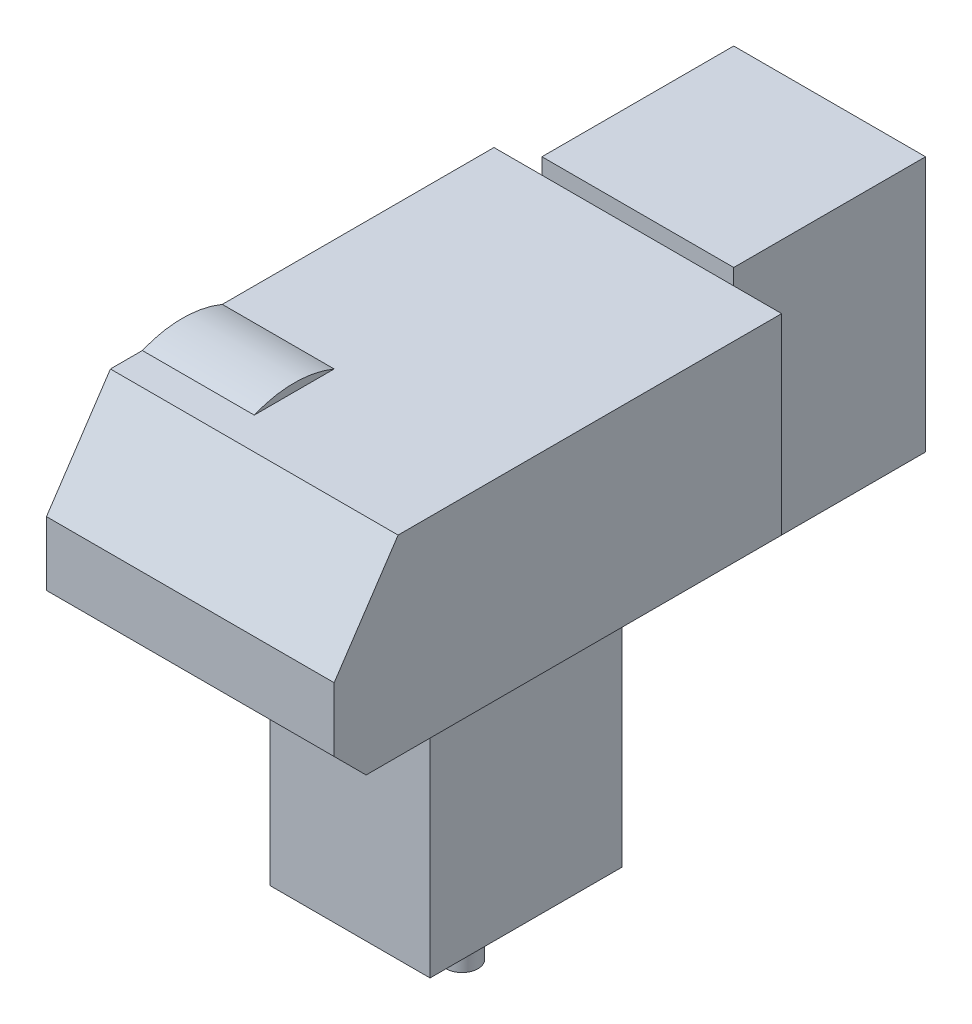
from build123d import *

# Parameters (mm, degrees)
SKETCH2_W           = 127
SKETCH2_H           = 152.4
BOSS_EXTRUDE2_DEPTH = 215.9
SKETCH3_W           = 228.6
SKETCH3_H           = 355.6
BOSS_EXTRUDE3_DEPTH = 152.4
SKETCH4_R           = 82.55
BOSS_EXTRUDE4_DEPTH = 88.9
CUT_EXTRUDE1_DEPTH  = 484.643280218
SKETCH6_W           = 152.4
SKETCH6_H           = 203.2
BOSS_EXTRUDE5_DEPTH = 152.4
SKETCH7_R           = 12.7
BOSS_EXTRUDE6_DEPTH = 63.5


with BuildPart() as part:
    # Sketch2 → Boss-Extrude2 (new body)
    with BuildSketch(Plane(origin=(0, 0, 0), x_dir=(1, 0, 0), z_dir=(0, 1, 0))):
        Rectangle(SKETCH2_W, SKETCH2_H)
    extrude(amount=BOSS_EXTRUDE2_DEPTH)

    # Sketch3 → Boss-Extrude3 (add)
    with BuildSketch(Plane(origin=(0, 215.9, 0), x_dir=(1, 0, 0), z_dir=(0, 1, 0))):
        with Locations((0, -25.4)):
            Rectangle(SKETCH3_W, SKETCH3_H)
    extrude(amount=BOSS_EXTRUDE3_DEPTH)

    # Sketch4 → Boss-Extrude4 (add)
    with BuildSketch(Plane.ZY.offset(114.3)):
        with Locations((95.25, 292.1)):
            Circle(SKETCH4_R)
    extrude(amount=-BOSS_EXTRUDE4_DEPTH)

    # Sketch5 → Cut-Extrude1 (cut, through all)
    with BuildSketch(Plane.ZY.offset(114.3)):
        Polygon((152.4, 368.3), (203.2, 292.1), (203.2, 368.3), align=None)
        Polygon((203.2, 215.9), (203.2, 241.3), (177.8, 215.9), align=None)
    extrude(amount=-CUT_EXTRUDE1_DEPTH, mode=Mode.SUBTRACT)

    # Sketch6 → Boss-Extrude5 (add)
    with BuildSketch(Plane(origin=(0, 0, -152.4), x_dir=(-1, 0, 0), z_dir=(0, 0, -1))):
        with Locations((0, 279.4)):
            Rectangle(SKETCH6_W, SKETCH6_H)
    extrude(amount=BOSS_EXTRUDE5_DEPTH)

    # Sketch7 → Boss-Extrude6 (add)
    with BuildSketch(Plane.XZ):
        with Locations(Location((0, -12.7, 0), (0, 0, 270))):
            Circle(SKETCH7_R)
    extrude(amount=BOSS_EXTRUDE6_DEPTH)


solid = part.part
